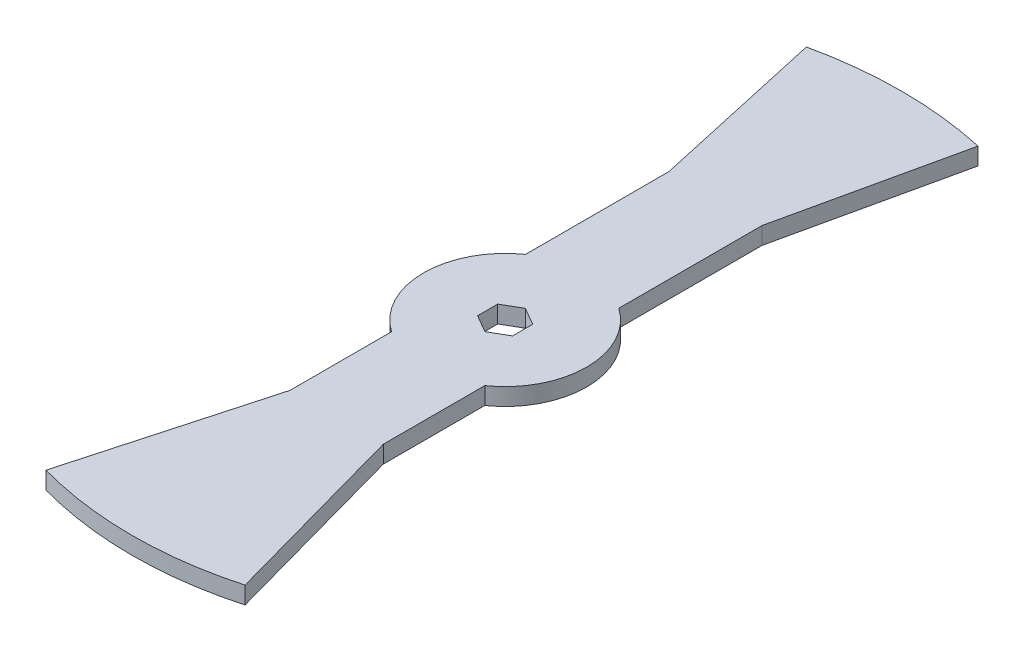
from build123d import *

# Parameters (mm, degrees)
BOSS_EXTRUDE1_DEPTH = 2.3495
CUT_EXTRUDE1_REACH  = 113.399
SKETCH3_R           = 22.225
BOSS_EXTRUDE2_DEPTH = 4.699


with BuildPart() as part:
    # Sketch1 → Boss-Extrude1 (new, symmetric)
    with BuildSketch(Plane(origin=(0, 0, 0), x_dir=(1, 0, 0), z_dir=(0, 1, 0))):
        with BuildLine():
            Line((-12.7, 57.285997997), (-12.7, -45.888631599))
            Line((-12.7, -45.888631599), (-27.099810626, -97.919151671))
            ThreePointArc((-27.099810626, -97.919151671), (0, -101.6), (27.099810626, -97.919151671))
            Line((27.099810626, -97.919151671), (12.7, -45.888631599))
            Line((12.7, -45.888631599), (12.7, 57.285997997))
            Line((12.7, 57.285997997), (23.364656325, 105.391153969))
            ThreePointArc((23.364656325, 105.391153969), (0, 107.95), (-23.364656325, 105.391153969))
            Line((-23.364656325, 105.391153969), (-12.7, 57.285997997))
        make_face()
    extrude(amount=BOSS_EXTRUDE1_DEPTH, both=True)

    # Sketch2 → Cut-Extrude1 (cut, up to next)
    with BuildSketch(Plane(origin=(0, 2.3495, 0), x_dir=(1, 0, 0), z_dir=(0, 1, 0)), mode=Mode.PRIVATE) as cut_extrude1_sk1:
        Polygon((4.7625, -2.749630657), (4.7625, 2.749630657), (0, 5.499261314), (-4.7625, 2.749630657), (-4.7625, -2.749630657), (0, -5.499261314), align=None)
    cut_extrude1_tool1 = extrude(cut_extrude1_sk1.sketch, amount=-CUT_EXTRUDE1_REACH, mode=Mode.PRIVATE) & part.part
    add(cut_extrude1_tool1.solids().sort_by_distance((0, 2.3495, 0))[0], mode=Mode.SUBTRACT)

    # Sketch3 → Boss-Extrude2 (add)
    with BuildSketch(Plane.XZ.offset(2.3495)):
        Circle(SKETCH3_R)
        Polygon((4.7625, -2.749630657), (0, -5.499261314), (-4.7625, -2.749630657), (-4.7625, 2.749630657), (0, 5.499261314), (4.7625, 2.749630657), align=None, mode=Mode.SUBTRACT)
    extrude(amount=-BOSS_EXTRUDE2_DEPTH)


solid = part.part
